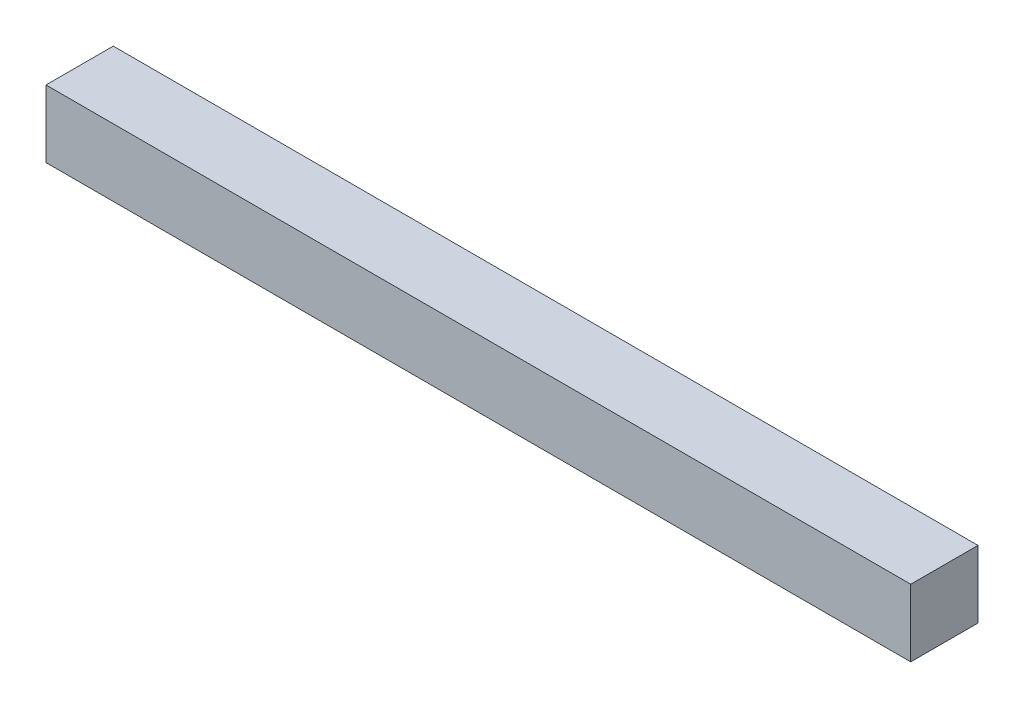
from build123d import *

# Parameters (mm, degrees)
SKETCH1_W           = 25.4
SKETCH1_H           = 25.4
BOSS_EXTRUDE1_DEPTH = 326.569392859


with BuildPart() as part:
    # Sketch1 → Boss-Extrude1 (new body)
    with BuildSketch(Plane(origin=(0, 0, 0), x_dir=(0, 0, -1), z_dir=(1, 0, 0))):
        Rectangle(SKETCH1_W, SKETCH1_H)
    extrude(amount=BOSS_EXTRUDE1_DEPTH)


solid = part.part
